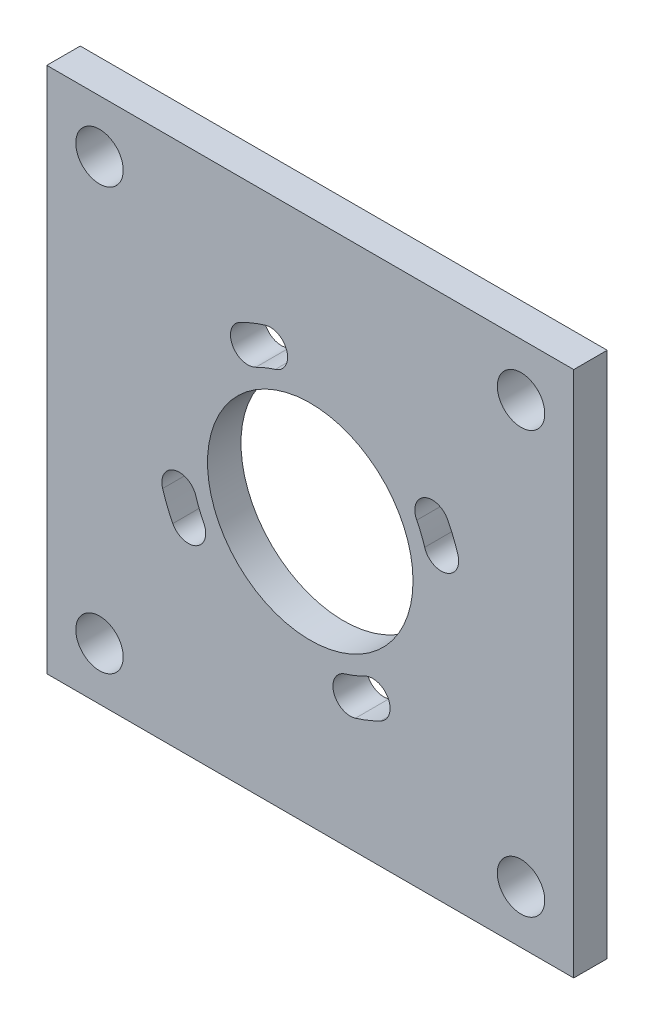
from build123d import *

# Parameters (mm, degrees)
SKETCH1_W           = 50
SKETCH1_H           = 50
BOSS_EXTRUDE1_DEPTH = 3.175
SKETCH2_R           = 9.75
CUT_EXTRUDE1_DEPTH  = 36.497614356
CUT_EXTRUDE2_DEPTH  = 36.497614356
SKETCH4_R           = 2.25
CUT_EXTRUDE3_DEPTH  = 36.497614356


with BuildPart() as part:
    # Sketch1 → Boss-Extrude1 (new body)
    with BuildSketch(Plane.XY):
        Rectangle(SKETCH1_W, SKETCH1_H)
    extrude(amount=BOSS_EXTRUDE1_DEPTH)

    # Sketch2 → Cut-Extrude1 (cut, through all)
    with BuildSketch(Plane.XY.offset(3.175)):
        Circle(SKETCH2_R)
    extrude(amount=-CUT_EXTRUDE1_DEPTH, mode=Mode.SUBTRACT)

    # Sketch3 → Cut-Extrude2 (cut, through all)
    with BuildSketch(Plane.XY.offset(3.175)):
        with BuildLine():
            ThreePointArc((-4.283245474, 14.009864675), (-5.500937795, 13.57800366), (-6.675845238, 13.040536429))
            ThreePointArc((-6.675845238, 13.040536429), (-7.392687591, 10.819920064), (-5.172071225, 10.103077711))
            ThreePointArc((-5.172071225, 10.103077711), (-4.261818701, 10.519477238), (-3.318418849, 10.85405898))
            ThreePointArc((-3.318418849, 10.85405898), (-2.222929314, 12.91437514), (-4.283245474, 14.009864675))
        make_face()
        with BuildLine():
            ThreePointArc((14.009864675, 4.283245474), (13.57800366, 5.500937795), (13.040536429, 6.675845238))
            ThreePointArc((13.040536429, 6.675845238), (10.819920064, 7.392687591), (10.103077711, 5.172071225))
            ThreePointArc((10.103077711, 5.172071225), (10.519477238, 4.261818701), (10.85405898, 3.318418849))
            ThreePointArc((10.85405898, 3.318418849), (12.91437514, 2.222929314), (14.009864675, 4.283245474))
        make_face()
        with BuildLine():
            ThreePointArc((4.283245474, -14.009864675), (5.500937795, -13.57800366), (6.675845238, -13.040536429))
            ThreePointArc((6.675845238, -13.040536429), (7.392687591, -10.819920064), (5.172071225, -10.103077711))
            ThreePointArc((5.172071225, -10.103077711), (4.261818701, -10.519477238), (3.318418849, -10.85405898))
            ThreePointArc((3.318418849, -10.85405898), (2.222929314, -12.91437514), (4.283245474, -14.009864675))
        make_face()
        with BuildLine():
            ThreePointArc((-14.009864675, -4.283245474), (-13.57800366, -5.500937795), (-13.040536429, -6.675845238))
            ThreePointArc((-13.040536429, -6.675845238), (-10.819920064, -7.392687591), (-10.103077711, -5.172071225))
            ThreePointArc((-10.103077711, -5.172071225), (-10.519477238, -4.261818701), (-10.85405898, -3.318418849))
            ThreePointArc((-10.85405898, -3.318418849), (-12.91437514, -2.222929314), (-14.009864675, -4.283245474))
        make_face()
    extrude(amount=-CUT_EXTRUDE2_DEPTH, mode=Mode.SUBTRACT)

    # Sketch4 → Cut-Extrude3 (cut, through all)
    with BuildSketch(Plane.XY.offset(3.175)):
        with Locations((-20, 20)):
            Circle(SKETCH4_R)
        with Locations(Location((-20, -20, 0), (0, 0, 180))):
            Circle(SKETCH4_R)
        with Locations(Location((20, 20, 0), (0, 0, 180))):
            Circle(SKETCH4_R)
        with Locations((20, -20)):
            Circle(SKETCH4_R)
    extrude(amount=-CUT_EXTRUDE3_DEPTH, mode=Mode.SUBTRACT)


solid = part.part
